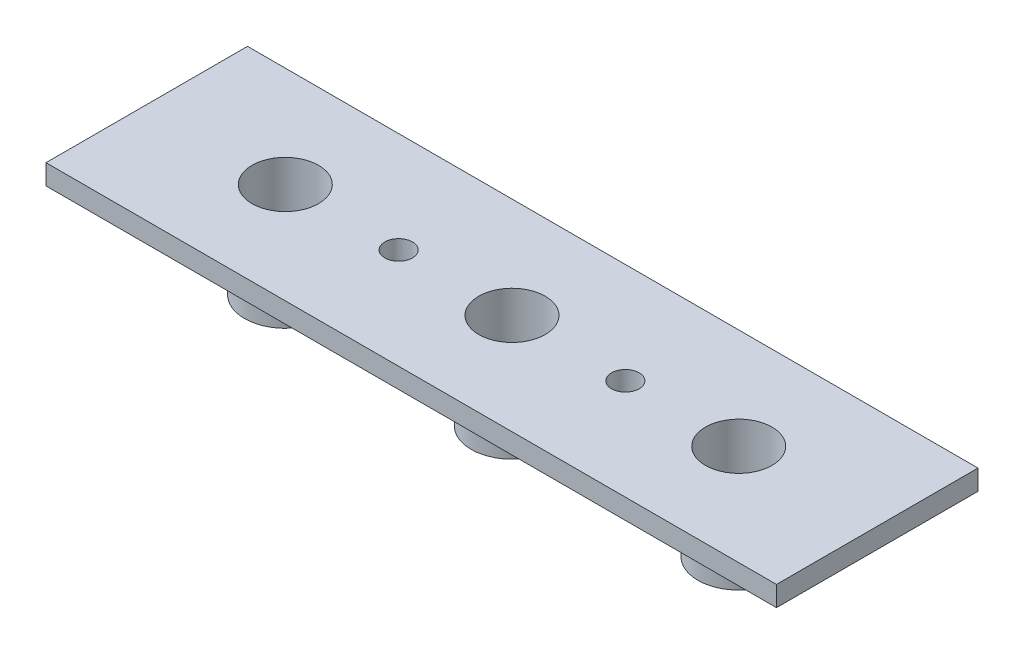
from build123d import *

# Parameters (mm, degrees)
BOSS_EXTRUDE3_DEPTH = 4
BOSS_EXTRUDE4_START = -15
BOSS_EXTRUDE4_DEPTH = 15
SKETCH3_R           = 2.75
CUT_EXTRUDE1_DEPTH  = 74


with BuildPart() as part:
    # Sketch2 → Boss-Extrude3 (new body)
    with BuildSketch(Plane(origin=(0, 0, 0), x_dir=(1, 0, 0), z_dir=(0, 1, 0))):
        with BuildLine():
            Line((45, 20), (-27.5, 20))
            Line((-27.5, 20), (-27.5, 0))
            Line((-27.5, 0), (-8.1, 0))
            ThreePointArc((-8.1, 0), (0, 8.1), (8.1, 0))
            Line((8.1, 0), (36.9, 0))
            ThreePointArc((36.9, 0), (39.272435072, 5.727564928), (45, 8.1))
            Line((45, 8.1), (45, 20))
        make_face()
        with BuildLine():
            ThreePointArc((8.1, 0), (0, 8.1), (-8.1, 0))
            Line((-8.1, 0), (-6.6, 0))
            ThreePointArc((-6.6, 0), (0, 6.6), (6.6, 0))
            Line((6.6, 0), (8.1, 0))
        make_face()
        with BuildLine():
            Line((-6.6, 0), (-8.1, 0))
            ThreePointArc((-8.1, 0), (0, -8.1), (8.1, 0))
            Line((8.1, 0), (6.6, 0))
            ThreePointArc((6.6, 0), (0, -6.6), (-6.6, 0))
        make_face()
        with BuildLine():
            ThreePointArc((53.1, 0), (50.727564928, 5.727564928), (45, 8.1))
            Line((45, 8.1), (45, 6.6))
            ThreePointArc((45, 6.6), (49.666904756, 4.666904756), (51.6, 0))
            Line((51.6, 0), (53.1, 0))
        make_face()
        with BuildLine():
            Line((45, 6.6), (45, 8.1))
            ThreePointArc((45, 8.1), (39.272435072, 5.727564928), (36.9, 0))
            Line((36.9, 0), (38.4, 0))
            ThreePointArc((38.4, 0), (40.333095244, 4.666904756), (45, 6.6))
        make_face()
        with BuildLine():
            ThreePointArc((36.9, 0), (45, -8.1), (53.1, 0))
            Line((53.1, 0), (51.6, 0))
            ThreePointArc((51.6, 0), (45, -6.6), (38.4, 0))
            Line((38.4, 0), (36.9, 0))
        make_face()
        with BuildLine():
            ThreePointArc((81.9, 0), (90, -8.1), (98.1, 0))
            Line((98.1, 0), (96.6, 0))
            ThreePointArc((96.6, 0), (90, -6.6), (83.4, 0))
            Line((83.4, 0), (81.9, 0))
        make_face()
        with BuildLine():
            Line((96.6, 0), (98.1, 0))
            ThreePointArc((98.1, 0), (90, 8.1), (81.9, 0))
            Line((81.9, 0), (83.4, 0))
            ThreePointArc((83.4, 0), (90, 6.6), (96.6, 0))
        make_face()
        with BuildLine():
            Line((117.5, 20), (45, 20))
            Line((45, 20), (45, 8.1))
            ThreePointArc((45, 8.1), (50.727564928, 5.727564928), (53.1, 0))
            Line((53.1, 0), (81.9, 0))
            ThreePointArc((81.9, 0), (90, 8.1), (98.1, 0))
            Line((98.1, 0), (117.5, 0))
            Line((117.5, 0), (117.5, 20))
        make_face()
        with BuildLine():
            Line((-8.1, 0), (-27.5, 0))
            Line((-27.5, 0), (-27.5, -20))
            Line((-27.5, -20), (117.5, -20))
            Line((117.5, -20), (117.5, 0))
            Line((117.5, 0), (98.1, 0))
            ThreePointArc((98.1, 0), (90, -8.1), (81.9, 0))
            Line((81.9, 0), (53.1, 0))
            ThreePointArc((53.1, 0), (45, -8.1), (36.9, 0))
            Line((36.9, 0), (8.1, 0))
            ThreePointArc((8.1, 0), (0, -8.1), (-8.1, 0))
        make_face()
    extrude(amount=BOSS_EXTRUDE3_DEPTH)

    # Sketch2<5> → Boss-Extrude4 (add)
    with BuildSketch(Plane(origin=(0, 0, 0), x_dir=(1, 0, 0), z_dir=(0, 1, 0)).offset(BOSS_EXTRUDE4_START)):
        with BuildLine():
            ThreePointArc((8.1, 0), (0, 8.1), (-8.1, 0))
            Line((-8.1, 0), (-6.6, 0))
            ThreePointArc((-6.6, 0), (0, 6.6), (6.6, 0))
            Line((6.6, 0), (8.1, 0))
        make_face()
        with BuildLine():
            Line((-6.6, 0), (-8.1, 0))
            ThreePointArc((-8.1, 0), (0, -8.1), (8.1, 0))
            Line((8.1, 0), (6.6, 0))
            ThreePointArc((6.6, 0), (0, -6.6), (-6.6, 0))
        make_face()
        with BuildLine():
            ThreePointArc((53.1, 0), (50.727564928, 5.727564928), (45, 8.1))
            Line((45, 8.1), (45, 6.6))
            ThreePointArc((45, 6.6), (49.666904756, 4.666904756), (51.6, 0))
            Line((51.6, 0), (53.1, 0))
        make_face()
        with BuildLine():
            Line((45, 6.6), (45, 8.1))
            ThreePointArc((45, 8.1), (39.272435072, 5.727564928), (36.9, 0))
            Line((36.9, 0), (38.4, 0))
            ThreePointArc((38.4, 0), (40.333095244, 4.666904756), (45, 6.6))
        make_face()
        with BuildLine():
            ThreePointArc((36.9, 0), (45, -8.1), (53.1, 0))
            Line((53.1, 0), (51.6, 0))
            ThreePointArc((51.6, 0), (45, -6.6), (38.4, 0))
            Line((38.4, 0), (36.9, 0))
        make_face()
        with BuildLine():
            ThreePointArc((81.9, 0), (90, -8.1), (98.1, 0))
            Line((98.1, 0), (96.6, 0))
            ThreePointArc((96.6, 0), (90, -6.6), (83.4, 0))
            Line((83.4, 0), (81.9, 0))
        make_face()
        with BuildLine():
            Line((96.6, 0), (98.1, 0))
            ThreePointArc((98.1, 0), (90, 8.1), (81.9, 0))
            Line((81.9, 0), (83.4, 0))
            ThreePointArc((83.4, 0), (90, 6.6), (96.6, 0))
        make_face()
    extrude(amount=BOSS_EXTRUDE4_DEPTH)

    # Sketch3 → Cut-Extrude1 (cut)
    with BuildSketch(Plane.XZ):
        with BuildLine():
            ThreePointArc((19.75, 0), (22.5, -2.75), (25.25, 0))
            Line((25.25, 0), (19.75, 0))
        make_face()
        with BuildLine():
            Line((19.75, 0), (25.25, 0))
            ThreePointArc((25.25, 0), (22.5, 2.75), (19.75, 0))
        make_face()
        with Locations(Location((67.5, 0, 0), (0, 0, 270))):
            Circle(SKETCH3_R)
    extrude(amount=-CUT_EXTRUDE1_DEPTH, mode=Mode.SUBTRACT)


solid = part.part
